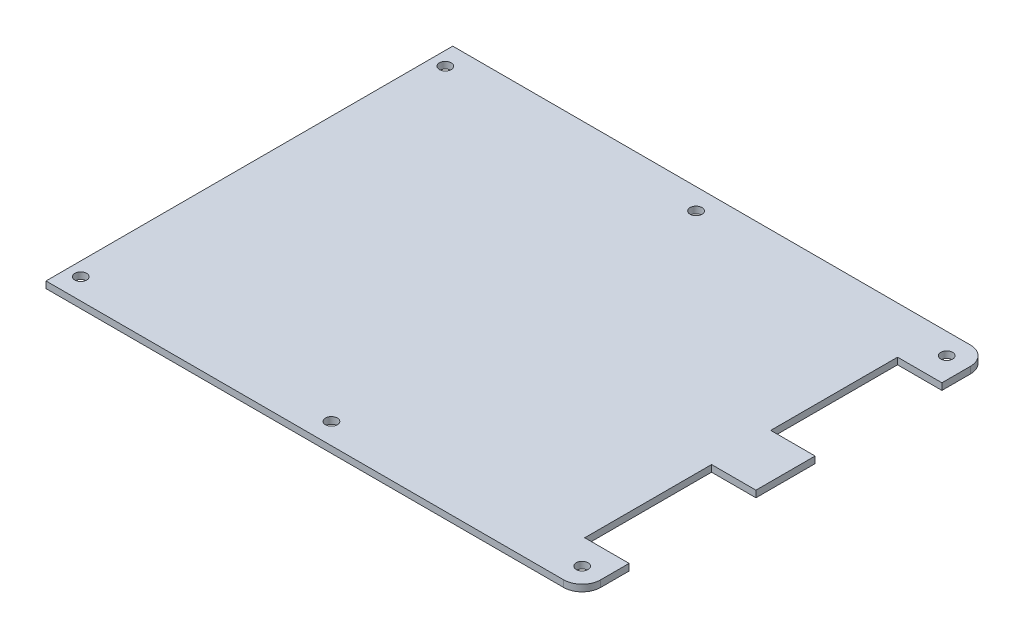
from build123d import *

# Parameters (mm, degrees)
BOSS_EXTRUDE2_DEPTH = 1.8
FILLET1_R           = 5
CUT_EXTRUDE1_REACH  = 93.019
SKETCH3_R           = 1.6


with BuildPart() as part:
    # Sketch2 → Boss-Extrude2 (new body)
    with BuildSketch(Plane(origin=(0, 0, 0), x_dir=(1, 0, 0), z_dir=(0, 1, 0))):
        Polygon((-72.5, -55), (72.5, -55), (72.5, -42.3), (60.5, -42.3), (60.5, -8), (72.5, -8), (72.5, 8), (60.5, 8), (60.5, 42.3), (72.5, 42.3), (72.5, 55), (-72.5, 55), align=None)
    extrude(amount=BOSS_EXTRUDE2_DEPTH)

    # Fillet1
    fillet1_edges = [part.edges().sort_by_distance(p)[0] for p in [
        (72.5, 0.9, 55),
        (72.5, 0.9, -55),
    ]]
    fillet(fillet1_edges, radius=FILLET1_R)

    # Sketch3 → Cut-Extrude1 (cut, up to next)
    with BuildSketch(Plane(origin=(0, 1.8, 0), x_dir=(1, 0, 0), z_dir=(0, 1, 0)), mode=Mode.PRIVATE) as cut_extrude1_sk1:
        with Locations(Location((-68.8, 49.3, 0), (0, 0, 270))):
            Circle(SKETCH3_R)
    cut_extrude1_tool1 = extrude(cut_extrude1_sk1.sketch, amount=-CUT_EXTRUDE1_REACH, mode=Mode.PRIVATE) & part.part
    # Sketch3 → Cut-Extrude1 (cut, up to next)
    with BuildSketch(Plane(origin=(0, 1.8, 0), x_dir=(1, 0, 0), z_dir=(0, 1, 0)), mode=Mode.PRIVATE) as cut_extrude1_sk2:
        with Locations(Location((-1, 49.3, 0), (0, 0, 270))):
            Circle(SKETCH3_R)
    cut_extrude1_tool2 = extrude(cut_extrude1_sk2.sketch, amount=-CUT_EXTRUDE1_REACH, mode=Mode.PRIVATE) & part.part
    # Sketch3 → Cut-Extrude1 (cut, up to next)
    with BuildSketch(Plane(origin=(0, 1.8, 0), x_dir=(1, 0, 0), z_dir=(0, 1, 0)), mode=Mode.PRIVATE) as cut_extrude1_sk3:
        with Locations(Location((-1, -49.3, 0), (0, 0, 270))):
            Circle(SKETCH3_R)
    cut_extrude1_tool3 = extrude(cut_extrude1_sk3.sketch, amount=-CUT_EXTRUDE1_REACH, mode=Mode.PRIVATE) & part.part
    # Sketch3 → Cut-Extrude1 (cut, up to next)
    with BuildSketch(Plane(origin=(0, 1.8, 0), x_dir=(1, 0, 0), z_dir=(0, 1, 0)), mode=Mode.PRIVATE) as cut_extrude1_sk4:
        with Locations(Location((-68.8, -49.3, 0), (0, 0, 270))):
            Circle(SKETCH3_R)
    cut_extrude1_tool4 = extrude(cut_extrude1_sk4.sketch, amount=-CUT_EXTRUDE1_REACH, mode=Mode.PRIVATE) & part.part
    # Sketch3 → Cut-Extrude1 (cut, up to next)
    with BuildSketch(Plane(origin=(0, 1.8, 0), x_dir=(1, 0, 0), z_dir=(0, 1, 0)), mode=Mode.PRIVATE) as cut_extrude1_sk5:
        with Locations(Location((66.8, 49.3, 0), (0, 0, 270))):
            Circle(SKETCH3_R)
    cut_extrude1_tool5 = extrude(cut_extrude1_sk5.sketch, amount=-CUT_EXTRUDE1_REACH, mode=Mode.PRIVATE) & part.part
    # Sketch3 → Cut-Extrude1 (cut, up to next)
    with BuildSketch(Plane(origin=(0, 1.8, 0), x_dir=(1, 0, 0), z_dir=(0, 1, 0)), mode=Mode.PRIVATE) as cut_extrude1_sk6:
        with Locations(Location((66.8, -49.3, 0), (0, 0, 270))):
            Circle(SKETCH3_R)
    cut_extrude1_tool6 = extrude(cut_extrude1_sk6.sketch, amount=-CUT_EXTRUDE1_REACH, mode=Mode.PRIVATE) & part.part
    add(cut_extrude1_tool1.solids().sort_by_distance((-68.8, 1.8, -49.3))[0], mode=Mode.SUBTRACT)
    add(cut_extrude1_tool2.solids().sort_by_distance((-1, 1.8, -49.3))[0], mode=Mode.SUBTRACT)
    add(cut_extrude1_tool3.solids().sort_by_distance((-1, 1.8, 49.3))[0], mode=Mode.SUBTRACT)
    add(cut_extrude1_tool4.solids().sort_by_distance((-68.8, 1.8, 49.3))[0], mode=Mode.SUBTRACT)
    add(cut_extrude1_tool5.solids().sort_by_distance((66.8, 1.8, -49.3))[0], mode=Mode.SUBTRACT)
    add(cut_extrude1_tool6.solids().sort_by_distance((66.8, 1.8, 49.3))[0], mode=Mode.SUBTRACT)


solid = part.part
